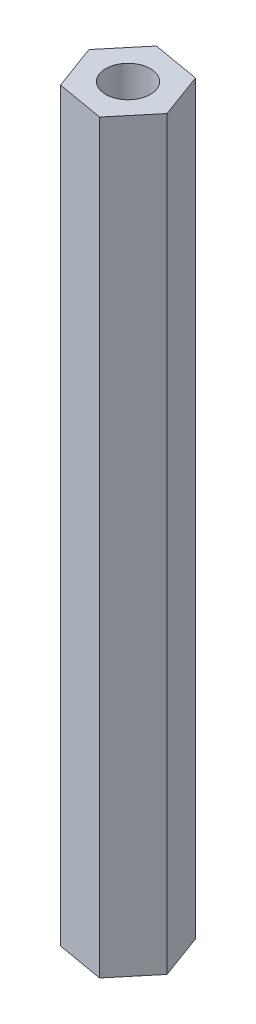
from build123d import *

# Parameters (mm, degrees)
SKETCH1_R           = 1.5
BOSS_EXTRUDE1_DEPTH = 50


with BuildPart() as part:
    # Sketch1 → Boss-Extrude1 (new body)
    with BuildSketch(Plane(origin=(0, 0, 0), x_dir=(1, 0, 0), z_dir=(0, 1, 0))):
        Polygon((1.111417275, -3.016021269), (3.167659675, -0.545495041), (2.0562424, 2.470526228), (-1.111417275, 3.016021269), (-3.167659675, 0.54549504), (-2.0562424, -2.470526228), align=None)
        with Locations(Location((0, 0, 0), (0, 0, 270))):
            Circle(SKETCH1_R, mode=Mode.SUBTRACT)
    extrude(amount=BOSS_EXTRUDE1_DEPTH)


solid = part.part
